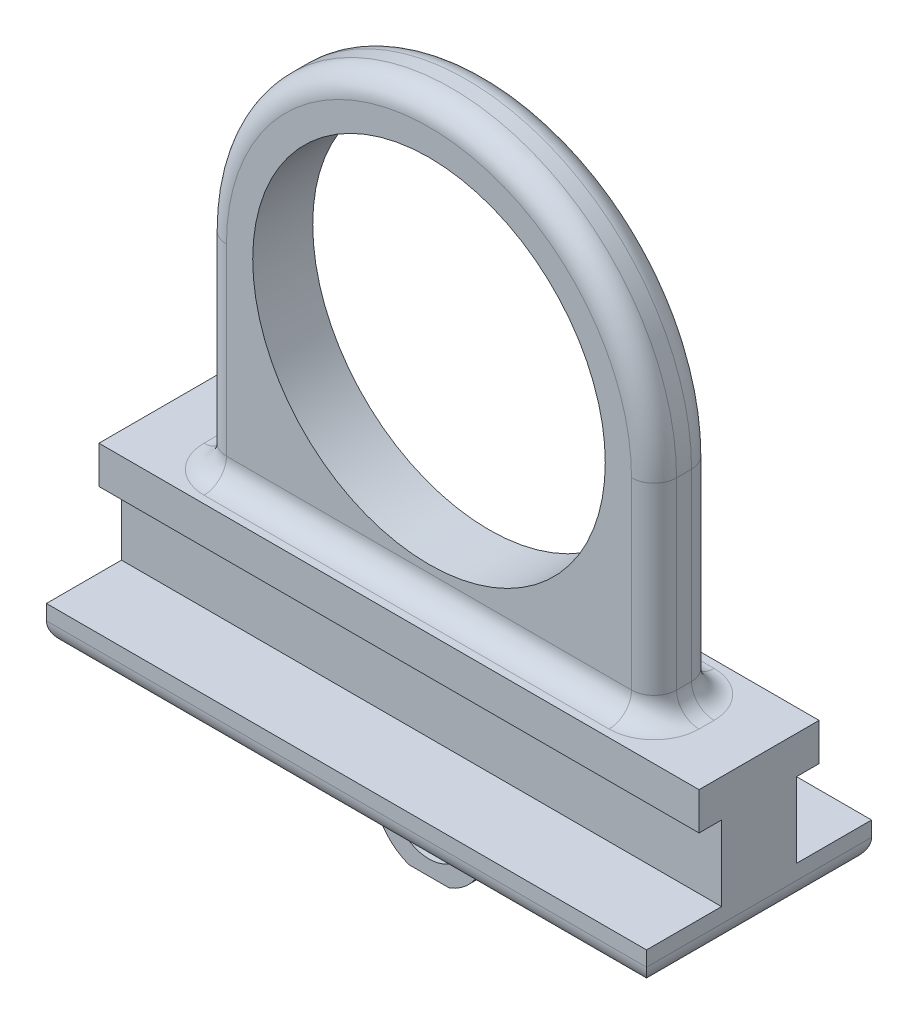
from build123d import *

# Parameters (mm, degrees)
SKETCH_1_R      = 23.5
EXTRUDE_1_DEPTH = 8
EXTRUDE_2_DEPTH = 70
FILLET_1_R      = 3
FILLET_2_R      = 3
EXTRUDE_3_DEPTH = 4


with BuildPart() as part:
    # 草图1 → 凸台-拉伸1 (new body)
    with BuildSketch(Plane.XY):
        with BuildLine():
            Line((30, -32.5), (-30, -32.5))
            Line((-30, -32.5), (-30, 0))
            ThreePointArc((-30, 0), (0, 30), (30, 0))
            Line((30, 0), (30, -32.5))
        make_face()
        Circle(SKETCH_1_R, mode=Mode.SUBTRACT)
    extrude(amount=EXTRUDE_1_DEPTH)

    # 草图2 → 凸台-拉伸2 (add)
    with BuildSketch(Plane(origin=(30, 0, 0), x_dir=(0, 0, -1), z_dir=(1, 0, 0))):
        Polygon((1, -32.5), (4, -32.5), (4, -27.5), (-12, -27.5), (-12, -32.5), (-9, -32.5), (-9, -42.5), (-19, -42.5), (-19, -47.5), (11, -47.5), (11, -42.5), (1, -42.5), align=None)
    extrude_2 = extrude(amount=-EXTRUDE_2_DEPTH)

    # 镜向1: 凸台-拉伸2 across plane
    add(extrude_2.mirror(Plane.ZY))

    # 圆角1
    fillet_1_edges = [part.edges().sort_by_distance(p)[0] for p in [
        (30, -13.75, 0),
        (30, -13.75, 8),
        (0, -27.5, 0),
        (-30, -27.5, 4),
        (0, -27.5, 8),
        (0, 30, 8),
        (-30, -13.75, 0),
        (0, 30, 0),
        (30, -27.5, 4),
        (-30, -13.75, 8),
    ]]
    fillet(fillet_1_edges, radius=FILLET_1_R)

    # 圆角2
    fillet_2_edges = [part.edges().sort_by_distance(p)[0] for p in [
        (-40, -47.5, 4),
        (0, -47.5, -11),
        (0, -47.5, 19),
        (40, -47.5, 4),
    ]]
    fillet(fillet_2_edges, radius=FILLET_2_R)

    # 草图4 → 凸台-拉伸3 (add, symmetric)
    with BuildSketch(Plane.XY.offset(4)):
        with BuildLine():
            Line((7.5, -47.5), (5, -47.5))
            Line((5, -47.5), (5, -52.5))
            ThreePointArc((5, -52.5), (0, -57.5), (-5, -52.5))
            Line((-5, -52.5), (-5, -47.5))
            Line((-5, -47.5), (-7.5, -47.5))
            Line((-7.5, -47.5), (-7.5, -52.5))
            ThreePointArc((-7.5, -52.5), (-6.18240924, -56.745917567), (-2.692582404, -59.5))
            Line((-2.692582404, -59.5), (2.692582404, -59.5))
            ThreePointArc((2.692582404, -59.5), (6.18240924, -56.745917567), (7.5, -52.5))
            Line((7.5, -52.5), (7.5, -47.5))
        make_face()
    extrude(amount=EXTRUDE_3_DEPTH, both=True)


solid = part.part
